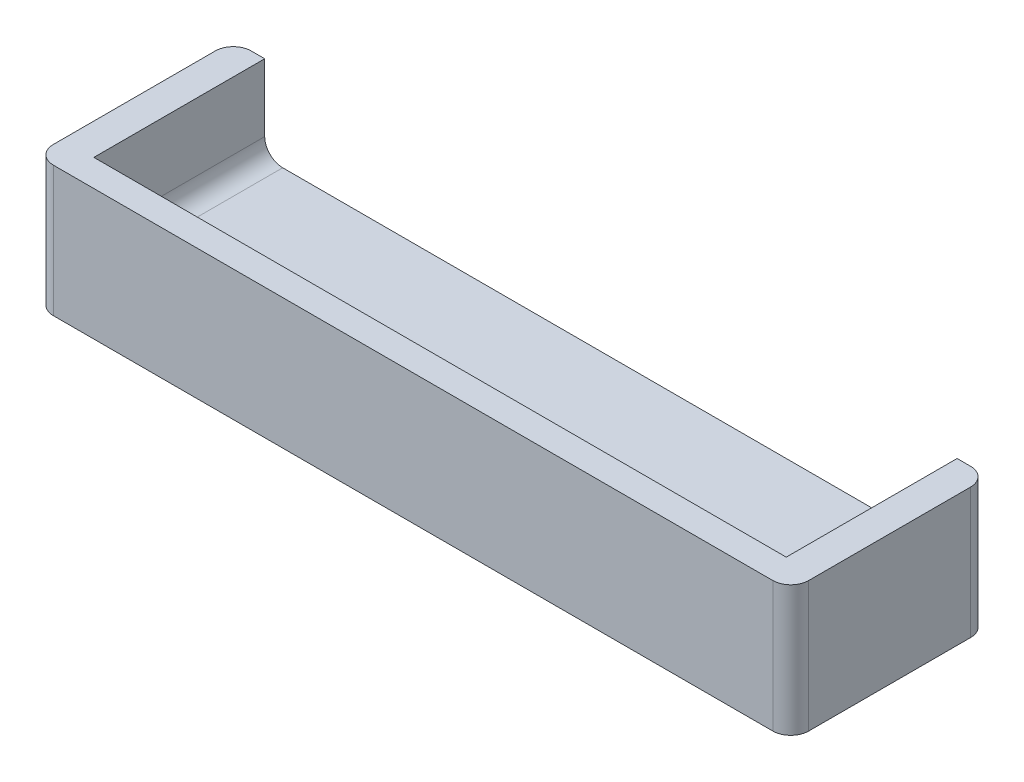
from build123d import *

# Parameters (mm, degrees)
SALIENTE_EXTRUIR1_DEPTH = 14
CROQUIS7_W              = 84
CROQUIS7_H              = 14.5
SALIENTE_EXTRUIR6_DEPTH = 3
SALIENTE_EXTRUIR7_DEPTH = 5
REDONDEO1_R             = 2


with BuildPart() as part:
    # Croquis1 → Saliente-Extruir1 (new body)
    with BuildSketch(Plane.XY):
        Polygon((-38.5, 7.25), (-42, 7.25), (-42, -7.25), (42, -7.25), (42, 7.25), (38.5, 7.25), (38.5, -2.25), (-38.5, -2.25), align=None)
    extrude(amount=SALIENTE_EXTRUIR1_DEPTH)

    # Croquis7 → Saliente-Extruir6 (add)
    with BuildSketch(Plane.XY.offset(14)):
        Rectangle(CROQUIS7_W, CROQUIS7_H)
    extrude(amount=SALIENTE_EXTRUIR6_DEPTH)

    # Croquis8 → Saliente-Extruir7 (add)
    with BuildSketch(Plane(origin=(0, 0, 0), x_dir=(-1, 0, 0), z_dir=(0, 0, -1))):
        Polygon((-42, 7.25), (-42, -7.25), (42, -7.25), (42, 7.25), (38.5, 7.25), (38.5, -2.25), (-38.5, -2.25), (-38.5, 7.25), align=None)
    extrude(amount=SALIENTE_EXTRUIR7_DEPTH)

    # Redondeo1
    redondeo1_edges = [part.edges().sort_by_distance(p)[0] for p in [
        (-38.5, -2.25, 4.5),
        (38.5, -2.25, 4.5),
        (-42, 0, 17),
        (42, 0, 17),
        (42, 0, -5),
        (-42, 0, -5),
    ]]
    fillet(redondeo1_edges, radius=REDONDEO1_R)


solid = part.part
